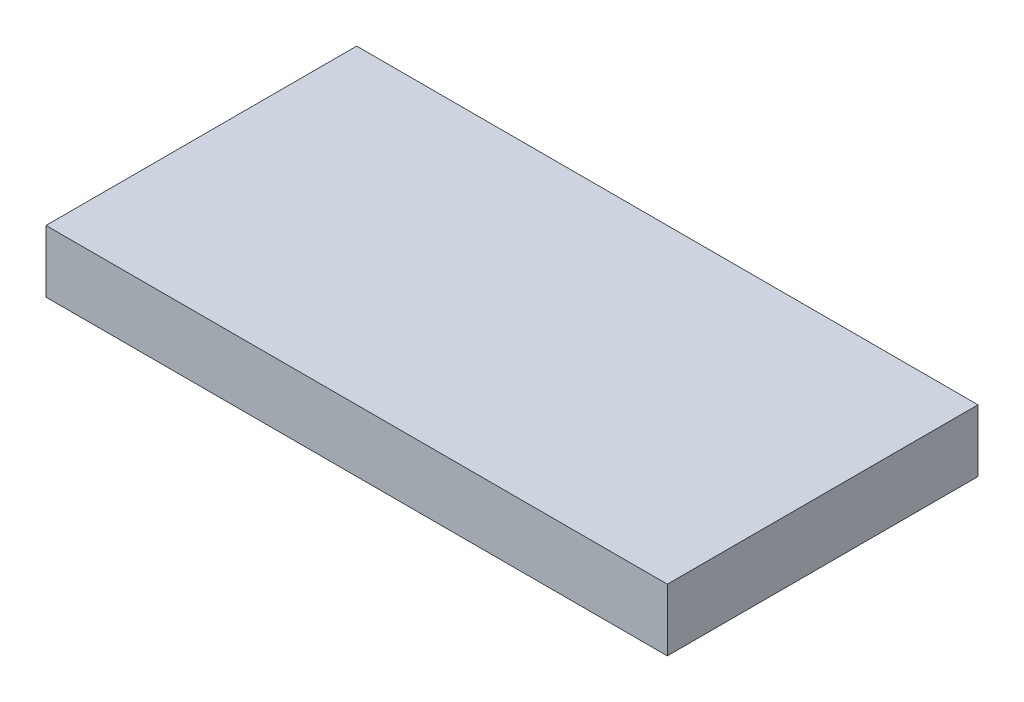
from build123d import *

# Parameters (mm, degrees)
SKETCH1_W           = 10
SKETCH1_H           = 5
BOSS_EXTRUDE1_DEPTH = 1


with BuildPart() as part:
    # Sketch1 → Boss-Extrude1 (new body)
    with BuildSketch(Plane(origin=(0, 0, 0), x_dir=(1, 0, 0), z_dir=(0, 1, 0))):
        with Locations((5, 2.5)):
            Rectangle(SKETCH1_W, SKETCH1_H)
    extrude(amount=BOSS_EXTRUDE1_DEPTH)


solid = part.part
